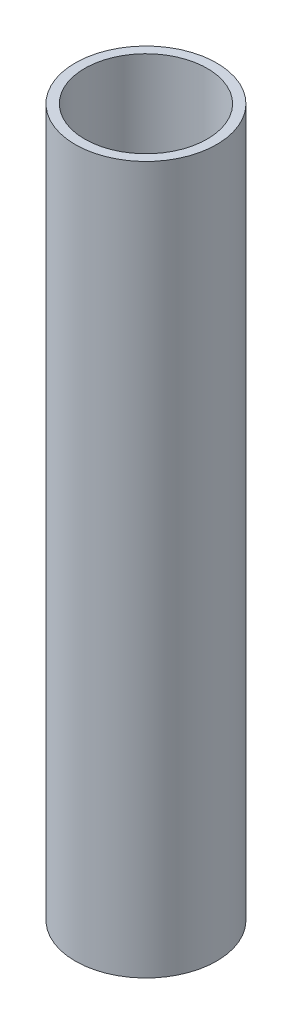
from build123d import *

# Parameters (mm, degrees)
SKETCH2_R           = 15
SKETCH2_R_2         = 13
BOSS_EXTRUDE1_DEPTH = 150


with BuildPart() as part:
    # Sketch2 → Boss-Extrude1 (new body)
    with BuildSketch(Plane(origin=(0, 0, 0), x_dir=(1, 0, 0), z_dir=(0, 1, 0))):
        with Locations(Location((0, 0, 0), (0, 0, 270))):
            Circle(SKETCH2_R)
        with Locations(Location((0, 0, 0), (0, 0, 270))):
            Circle(SKETCH2_R_2, mode=Mode.SUBTRACT)
    extrude(amount=BOSS_EXTRUDE1_DEPTH)


solid = part.part
